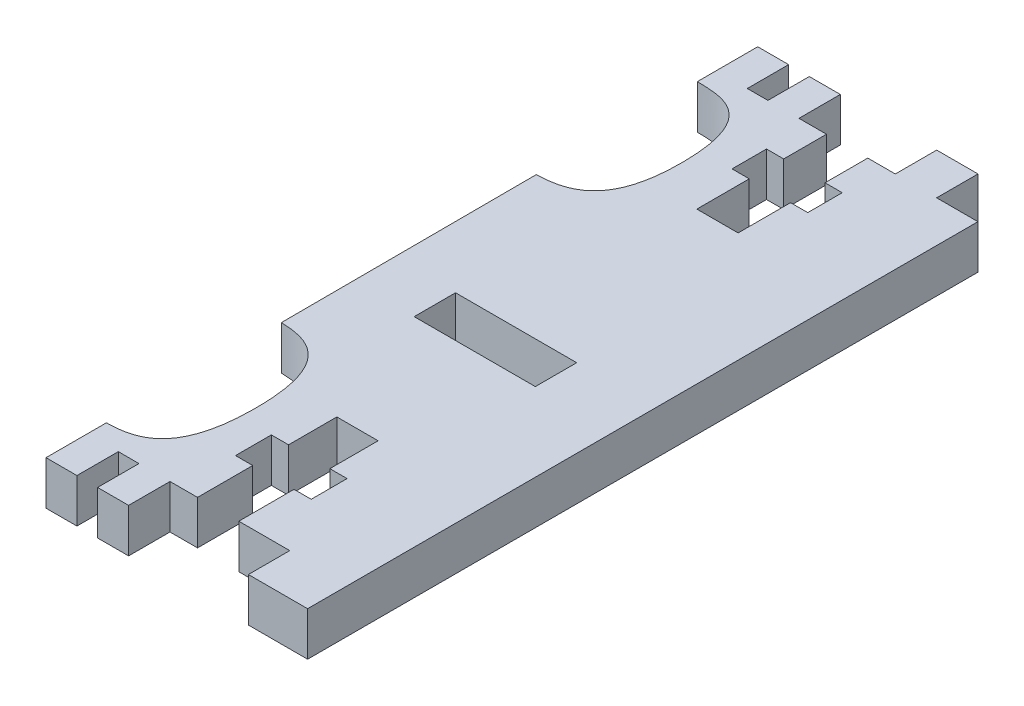
from build123d import *

# Parameters (mm, degrees)
SKETCH1_W           = 8.784371834
SKETCH1_H           = 3.000075643
BOSS_EXTRUDE1_DEPTH = 3.175


with BuildPart() as part:
    # Sketch1 → Boss-Extrude1 (new body)
    with BuildSketch(Plane(origin=(0, 0, 0), x_dir=(1, 0, 0), z_dir=(0, 1, 0))):
        with BuildLine():
            Line((-9.483120155, -21.470892841), (-9.483120155, -25.850971148))
            Line((-9.483120155, -25.850971148), (-7.240182549, -25.850971148))
            Line((-7.240182549, -25.850971148), (-7.240182549, -22.850827141))
            Line((-7.240182549, -22.850827141), (-5.742820851, -22.850827141))
            Line((-5.742820851, -22.850827141), (-5.742820851, -25.850971148))
            Line((-5.742820851, -25.850971148), (-3.493751351, -25.850971148))
            Line((-3.493751351, -25.850971148), (-3.493751351, -22.850827141))
            Line((-3.493751351, -22.850827141), (-1.497298333, -22.850827141))
            Line((-1.497298333, -22.850827141), (-1.497298333, -18.850679894))
            Line((-1.497298333, -18.850679894), (-2.745036382, -18.850679894))
            Line((-2.745036382, -18.850679894), (-2.745036382, -18.750702276))
            Line((-2.745036382, -18.750702276), (-2.745036382, -16.250563552))
            Line((-2.745036382, -16.250563552), (-1.497298333, -16.250563552))
            Line((-1.497298333, -16.250563552), (-1.497298333, -12.750414262))
            Line((-1.497298333, -12.750414262), (1.49723009, -12.750414262))
            Line((1.49723009, -12.750414262), (1.49723009, -16.250563552))
            Line((1.49723009, -16.250563552), (2.745046129, -16.250563552))
            Line((2.745046129, -16.250563552), (2.745046129, -18.750702276))
            Line((2.745046129, -18.750702276), (2.745046129, -18.850679894))
            Line((2.745046129, -18.850679894), (1.49723009, -18.850679894))
            Line((1.49723009, -18.850679894), (1.49723009, -22.850827141))
            Line((1.49723009, -22.850827141), (5.190823665, -22.850827141))
            Line((5.190823665, -22.850827141), (5.190823665, -25.850971148))
            Line((5.190823665, -25.850971148), (9.483120155, -25.850971148))
            Line((9.483120155, -25.850971148), (9.483120155, 22.750856849))
            Line((9.483120155, 22.750856849), (6.488418889, 22.750856849))
            Line((6.488418889, 22.750856849), (6.488418889, 25.750995973))
            Line((6.488418889, 25.750995973), (3.493705241, 25.750995973))
            Line((3.493705241, 25.750995973), (3.493705241, 22.750856849))
            Line((3.493705241, 22.750856849), (1.497242474, 22.750856849))
            Line((1.497242474, 22.750856849), (1.497242474, 19.650735225))
            Line((1.497242474, 19.650735225), (2.745058512, 19.650735225))
            Line((2.745058512, 19.650735225), (2.745058512, 17.150659981))
            Line((2.745058512, 17.150659981), (1.497242474, 17.150659981))
            Line((1.497242474, 17.150659981), (1.497242474, 13.350397163))
            Line((1.497242474, 13.350397163), (-1.497285949, 13.350397163))
            Line((-1.497285949, 13.350397163), (-1.497285949, 17.150659981))
            Line((-1.497285949, 17.150659981), (-2.745023998, 17.150659981))
            Line((-2.745023998, 17.150659981), (-2.745023998, 19.650735225))
            Line((-2.745023998, 19.650735225), (-1.497285949, 19.650735225))
            Line((-1.497285949, 19.650735225), (-1.497285949, 22.750856849))
            Line((-1.497285949, 22.750856849), (-3.493751349, 22.750856849))
            Line((-3.493751349, 22.750856849), (-3.493751349, 25.750995973))
            Line((-3.493751349, 25.750995973), (-5.742820849, 25.750995973))
            Line((-5.742820849, 25.750995973), (-5.742820849, 22.750856849))
            Line((-5.742820849, 22.750856849), (-7.240182547, 22.750856849))
            Line((-7.240182547, 22.750856849), (-7.240182547, 25.750995973))
            Line((-7.240182547, 25.750995973), (-9.483120153, 25.750995973))
            Line((-9.483120153, 25.750995973), (-9.483120153, 21.370917666))
            add(Edge.make_bspline(
                [(-4.952518186, 15.886251248), (-5.015201934, 21.274211759), (-7.426547278, 21.343845481), (-9.483120153, 21.370917666)],
                knots=[6, 6, 6, 6, 7, 7, 7, 7], degree=3))
            add(Edge.make_bspline(
                [(-9.483120153, 9.692990904), (-7.240182547, 9.757380123), (-4.889844186, 10.498168659), (-4.952518186, 15.886251248)],
                knots=[5, 5, 5, 5, 6, 6, 6, 6], degree=3))
            Line((-9.483120153, 9.692990904), (-9.431179406, -8.834115587))
            add(Edge.make_bspline(
                [(-9.431179406, -8.834115587), (-7.188183308, -8.898499923), (-4.965366893, -9.64325846), (-4.995070997, -15.262909799)],
                knots=[1, 1, 1, 1, 2, 2, 2, 2], degree=3))
            add(Edge.make_bspline(
                [(-4.995070997, -15.262909799), (-5.024784848, -20.882307214), (-7.42654728, -21.443818214), (-9.483120155, -21.470892841)],
                knots=[2, 2, 2, 2, 3, 3, 3, 3], degree=3))
        make_face()
        with Locations((-0.598927132, -2.150035167)):
            Rectangle(SKETCH1_W, SKETCH1_H, mode=Mode.SUBTRACT)
    extrude(amount=BOSS_EXTRUDE1_DEPTH)


solid = part.part
